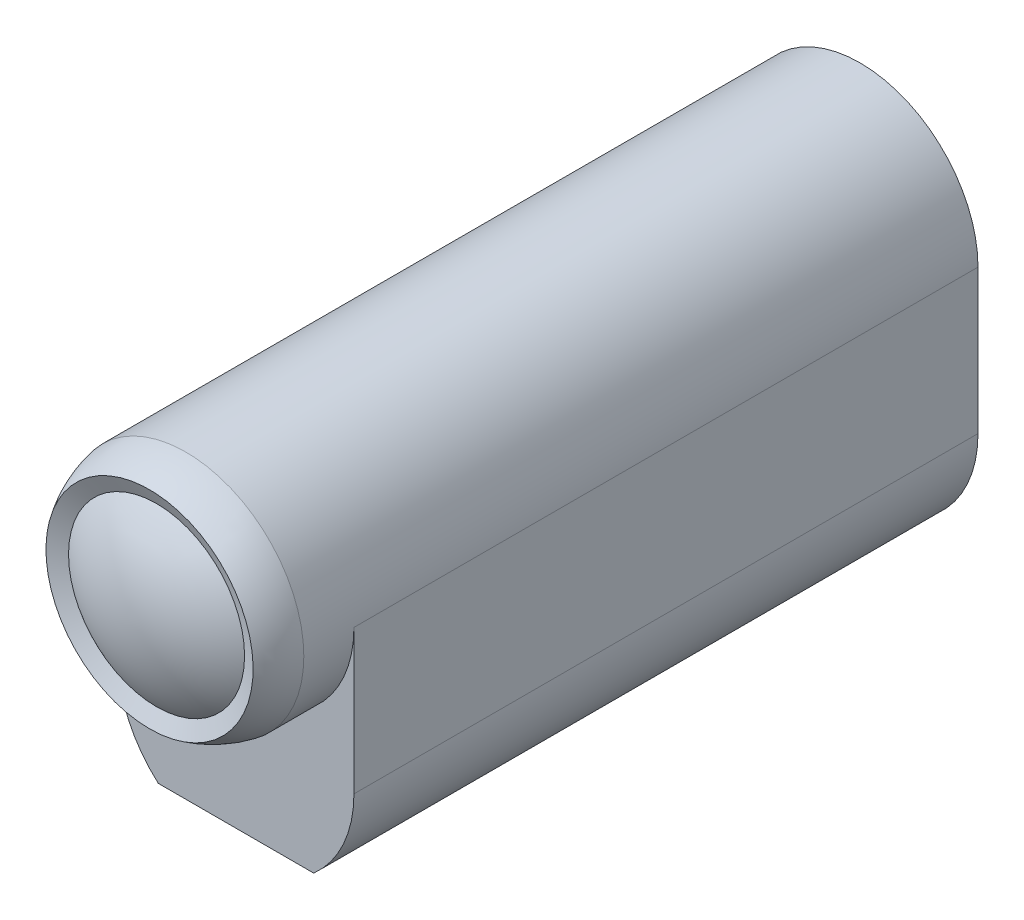
from build123d import *

# Parameters (mm, degrees)
BOSS_EXTRUDE1_DEPTH = 63.246
SKETCH2_R           = 11.953875
BOSS_EXTRUDE2_DEPTH = 5.08


with BuildPart() as part:
    # Sketch1 → Boss-Extrude1 (new body)
    with BuildSketch(Plane.XY):
        with BuildLine():
            Line((-7.874, -23.606125), (7.874, -23.606125))
            ThreePointArc((7.874, -23.606125), (10.886228439, -19.550079279), (11.953875, -14.611946243))
            Line((11.953875, -14.611946243), (11.953875, 0))
            ThreePointArc((11.953875, 0), (0, 11.953875), (-11.953875, 0))
            Line((-11.953875, 0), (-11.953875, -14.611946243))
            ThreePointArc((-11.953875, -14.611946243), (-10.886228439, -19.550079279), (-7.874, -23.606125))
        make_face()
    extrude(amount=BOSS_EXTRUDE1_DEPTH)

    # Sketch2 → Boss-Extrude2 (add)
    with BuildSketch(Plane.XY.offset(63.246)):
        Circle(SKETCH2_R)
    extrude(amount=BOSS_EXTRUDE2_DEPTH)

    # Sketch3 → Revolve1 (revolve)
    with BuildSketch(Plane(origin=(0, 0, 0), x_dir=(0, 0, -1), z_dir=(1, 0, 0)), mode=Mode.PRIVATE) as revolve1_sk:
        with BuildLine():
            Line((-74.2696, 0), (-68.326, 0))
            Line((-68.326, 0), (-68.326, 11.953875))
            ThreePointArc((-68.326, 11.953875), (-70.242328664, 11.415006517), (-72.009, 10.49763681))
            Line((-72.009, 10.49763681), (-71.2978, 8.921350892))
            ThreePointArc((-71.2978, 8.921350892), (-73.507109881, 4.701651225), (-74.2696, 0))
        make_face()
    revolve(revolve1_sk.sketch.rotate(Axis((0, 0, 74.2696), (0, 0, -1)), 180), axis=Axis((0, 0, 74.2696), (0, 0, -1)))


solid = part.part
